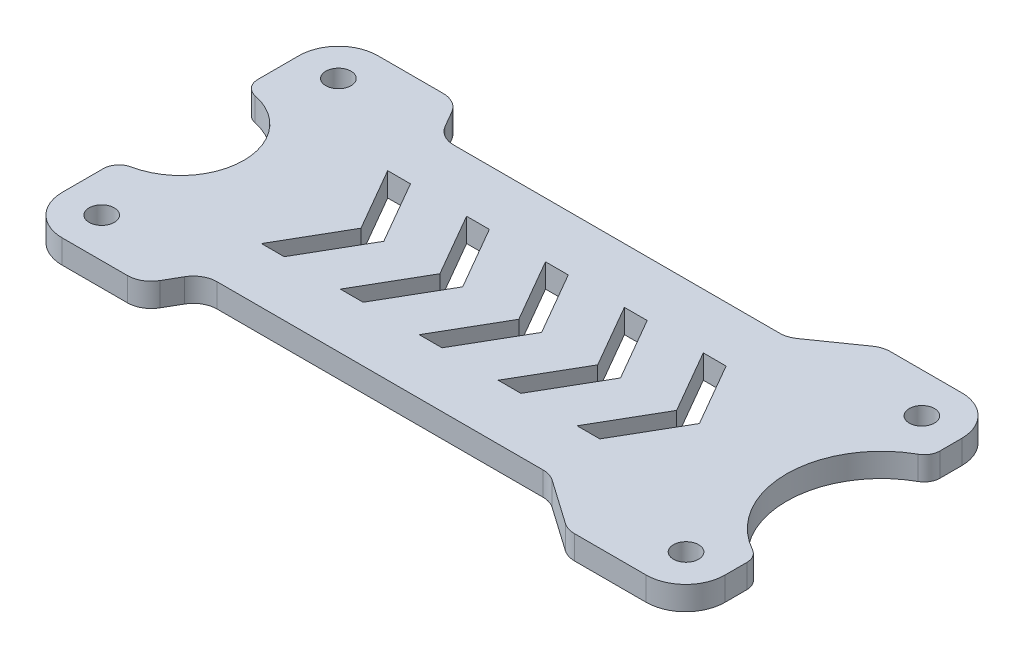
from build123d import *

# Parameters (mm, degrees)
SKETCH1_R           = 1.6
BOSS_EXTRUDE1_DEPTH = 3
CUT_EXTRUDE1_DEPTH  = 3
FILLET1_R           = 3
CUT_EXTRUDE2_DEPTH  = 47.615448083
FILLET2_R           = 2


with BuildPart() as part:
    # Sketch1 → Boss-Extrude1 (new body)
    with BuildSketch(Plane(origin=(0, 53, 0), x_dir=(1, 0, 0), z_dir=(0, 1, 0))):
        with BuildLine():
            Line((-37, 20), (37, 20))
            ThreePointArc((37, 20), (40.535533906, 18.535533906), (42, 15))
            Line((42, 15), (42, -15))
            ThreePointArc((42, -15), (40.535533906, -18.535533906), (37, -20))
            Line((37, -20), (-37, -20))
            ThreePointArc((-37, -20), (-40.535533906, -18.535533906), (-42, -15))
            Line((-42, -15), (-42, 15))
            ThreePointArc((-42, 15), (-40.535533906, 18.535533906), (-37, 20))
        make_face()
        with Locations(Location((37, 14.944086969, 0), (0, 0, 270))):
            Circle(SKETCH1_R, mode=Mode.SUBTRACT)
        with Locations(Location((37, -14.944086969, 0), (0, 0, 270))):
            Circle(SKETCH1_R, mode=Mode.SUBTRACT)
        with Locations(Location((-37, -15, 0), (0, 0, 270))):
            Circle(SKETCH1_R, mode=Mode.SUBTRACT)
        with Locations(Location((-37, 15, 0), (0, 0, 270))):
            Circle(SKETCH1_R, mode=Mode.SUBTRACT)
    extrude(amount=BOSS_EXTRUDE1_DEPTH)

    # Sketch2 → Cut-Extrude1 (cut)
    with BuildSketch(Plane(origin=(0, 56, 0), x_dir=(1, 0, 0), z_dir=(0, 1, 0))):
        Polygon((-27, 20), (-24.113248654, 15), (19.859259966, 15), (27, 20), align=None)
        Polygon((-27, -20), (27, -20), (19.859259966, -15), (-24.113248654, -15), align=None)
        with BuildLine():
            Line((42, 11), (42, -11))
            ThreePointArc((42, -11), (34.795831523, 0), (42, 11))
        make_face()
        with BuildLine():
            Line((-42, 8), (-42, -8))
            ThreePointArc((-42, -8), (-34, 0), (-42, 8))
        make_face()
    extrude(amount=-CUT_EXTRUDE1_DEPTH, mode=Mode.SUBTRACT)

    # Fillet1
    fillet1_edges = [part.edges().sort_by_distance(p)[0] for p in [
        (-24.113248654, 54.5, -15),
        (19.859259966, 54.5, -15),
        (27, 54.5, -20),
        (-27, 54.5, -20),
        (27, 54.5, 20),
        (19.859259966, 54.5, 15),
        (-24.113248654, 54.5, 15),
        (-27, 54.5, 20),
    ]]
    fillet(fillet1_edges, radius=FILLET1_R)

    # Sketch3 → Cut-Extrude2 (cut, through all)
    with BuildSketch(Plane(origin=(0, 56, 0), x_dir=(1, 0, 0), z_dir=(0, 1, 0))):
        Polygon((20.863248654, 0), (16.244446501, 8), (19.131197846, 8), (23.75, 0), (19.131197846, -8), (16.244446501, -8), align=None)
        Polygon((10.863248654, 0), (6.244446501, 8), (9.131197846, 8), (13.75, 0), (9.131197846, -8), (6.244446501, -8), align=None)
        Polygon((0.863248654, 0), (-3.755553499, 8), (-0.868802154, 8), (3.75, 0), (-0.868802154, -8), (-3.755553499, -8), align=None)
        Polygon((-9.136751346, 0), (-13.755553499, 8), (-10.868802154, 8), (-6.25, 0), (-10.868802154, -8), (-13.755553499, -8), align=None)
        Polygon((-19.136751346, 0), (-23.755553499, 8), (-20.868802154, 8), (-16.25, 0), (-20.868802154, -8), (-23.755553499, -8), align=None)
    extrude(amount=-CUT_EXTRUDE2_DEPTH, mode=Mode.SUBTRACT)

    # Fillet2
    fillet2_edges = [part.edges().sort_by_distance(p)[0] for p in [
        (42, 54.5, -11),
        (42, 54.5, 11),
        (-42, 54.5, 8),
        (-42, 54.5, -8),
    ]]
    fillet(fillet2_edges, radius=FILLET2_R)


solid = part.part
